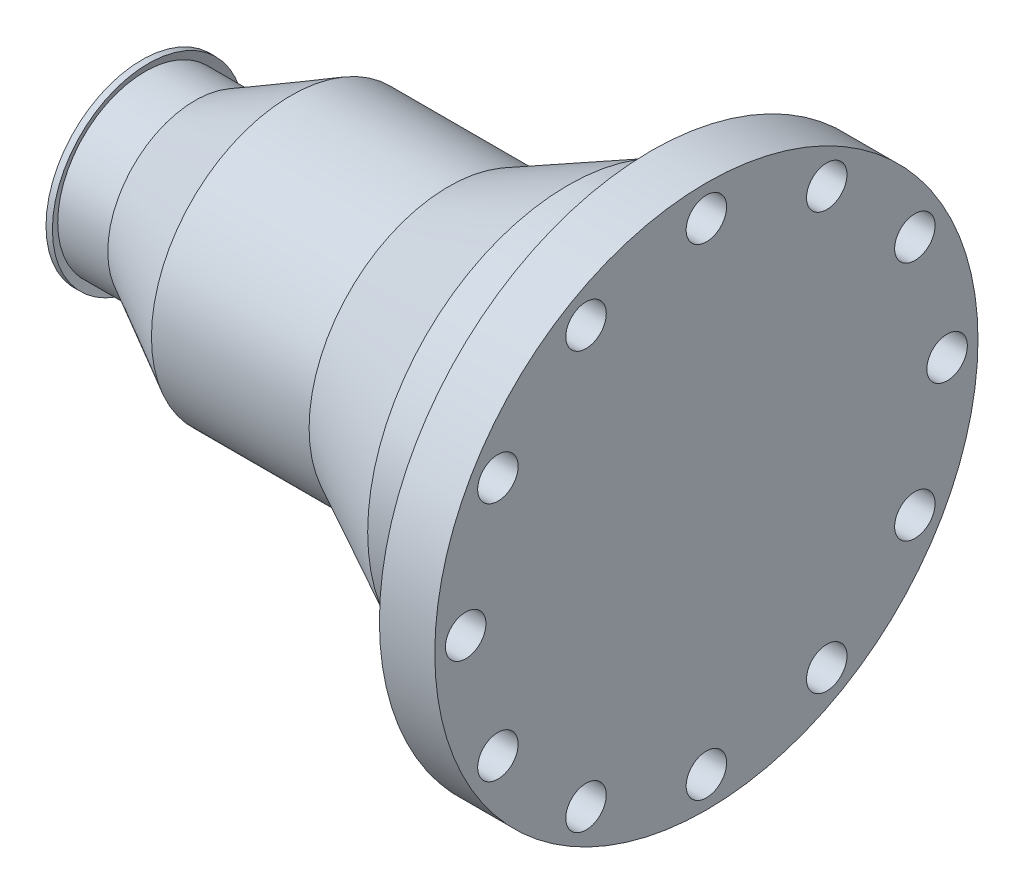
from build123d import *

# Parameters (mm, degrees)
SKETCH_3_R           = 9.5
CUT_EXTRUDE_1_DEPTH  = 321.526909947
SKETCH_4_R           = 9.5
CUT_EXTRUDE_2_DEPTH  = 321.526909947
SKETCH_5_R           = 9.5
CUT_EXTRUDE_3_DEPTH  = 321.526909947
SKETCH_6_R           = 9.5
CUT_EXTRUDE_4_DEPTH  = 321.526909947
SKETCH_7_R           = 9.5
CUT_EXTRUDE_5_DEPTH  = 321.526909947
SKETCH_8_R           = 9.5
CUT_EXTRUDE_6_DEPTH  = 321.526909947
SKETCH_9_R           = 9.5
CUT_EXTRUDE_7_DEPTH  = 321.526909947
SKETCH_10_R          = 9.5
CUT_EXTRUDE_8_DEPTH  = 321.526909947
SKETCH_11_R          = 9.5
CUT_EXTRUDE_9_DEPTH  = 321.526909947
SKETCH_12_R          = 9.5
CUT_EXTRUDE_10_DEPTH = 321.526909947
SKETCH_13_R          = 9.5
CUT_EXTRUDE_11_DEPTH = 321.526909947
SKETCH_14_R          = 9.5
CUT_EXTRUDE_12_DEPTH = 321.526909947


with BuildPart() as part:
    # Эскиз1 → Повернуть1 (revolve)
    with BuildSketch(Plane.XY, mode=Mode.PRIVATE) as revolve_1_sk:
        Polygon((0, 0), (265, 0), (265, 127.5), (239, 127.5), (239, 100), (239, 95), (220, 95), (220, 94), (200, 94), (144, 65.5), (70, 65.5), (25, 41), (1.5, 41), (3, 45), (0, 45), align=None)
    revolve(revolve_1_sk.sketch.rotate(Axis((0, 0, 0), (1, 0, 0)), 90), axis=Axis((0, 0, 0), (1, 0, 0)))

    # Эскиз2 → Вырез-Повернуть1 (revolve, cut)
    with BuildSketch(Plane.XY, mode=Mode.PRIVATE) as cut_revolve_1_sk:
        with BuildLine():
            Line((0, 0), (220, 0))
            Line((220, 0), (220, 38.502577))
            Line((220, 38.502577), (200, 38.502577))
            Line((200, 38.502577), (200, 55))
            Line((200, 55), (147.669872, 55))
            ThreePointArc((147.669872, 55), (146.273624348, 54.108499061), (146.669872, 52.5))
            Line((146.669872, 52.5), (143.5, 52.5))
            ThreePointArc((143.5, 52.5), (142.75, 52.602347572), (142, 52.5))
            Line((142, 52.5), (90, 52.5))
            ThreePointArc((90, 52.5), (79.13262933, 46.740617582), (70, 38.502577))
            Line((70, 38.502577), (42, 31))
            Line((42, 31), (0, 31))
            Line((0, 31), (0, 0))
        make_face()
    revolve(cut_revolve_1_sk.sketch.rotate(Axis((0, 0, 0), (1, 0, 0)), 90), axis=Axis((0, 0, 0), (1, 0, 0)), mode=Mode.SUBTRACT)

    # Эскиз3 → Вырез-Вытянуть1 (cut, through all)
    with BuildSketch(Plane(origin=(0, 0, 0), x_dir=(0, 0, -1), z_dir=(1, 0, 0))):
        with Locations((0, 113)):
            Circle(SKETCH_3_R)
    extrude(amount=CUT_EXTRUDE_1_DEPTH, mode=Mode.SUBTRACT)

    # Эскиз4 → Вырез-Вытянуть2 (cut, through all)
    with BuildSketch(Plane(origin=(0, 0, 0), x_dir=(0, 0, -1), z_dir=(1, 0, 0))):
        with Locations((-56.5, 97.860870628)):
            Circle(SKETCH_4_R)
    extrude(amount=CUT_EXTRUDE_2_DEPTH, mode=Mode.SUBTRACT)

    # Эскиз5 → Вырез-Вытянуть3 (cut, through all)
    with BuildSketch(Plane(origin=(0, 0, 0), x_dir=(0, 0, -1), z_dir=(1, 0, 0))):
        with Locations((-97.860870628, 56.5)):
            Circle(SKETCH_5_R)
    extrude(amount=CUT_EXTRUDE_3_DEPTH, mode=Mode.SUBTRACT)

    # Эскиз6 → Вырез-Вытянуть4 (cut, through all)
    with BuildSketch(Plane(origin=(0, 0, 0), x_dir=(0, 0, -1), z_dir=(1, 0, 0))):
        with Locations((-113, 0)):
            Circle(SKETCH_6_R)
    extrude(amount=CUT_EXTRUDE_4_DEPTH, mode=Mode.SUBTRACT)

    # Эскиз7 → Вырез-Вытянуть5 (cut, through all)
    with BuildSketch(Plane(origin=(0, 0, 0), x_dir=(0, 0, -1), z_dir=(1, 0, 0))):
        with Locations((-97.860870628, -56.5)):
            Circle(SKETCH_7_R)
    extrude(amount=CUT_EXTRUDE_5_DEPTH, mode=Mode.SUBTRACT)

    # Эскиз8 → Вырез-Вытянуть6 (cut, through all)
    with BuildSketch(Plane(origin=(0, 0, 0), x_dir=(0, 0, -1), z_dir=(1, 0, 0))):
        with Locations((-56.5, -97.860870628)):
            Circle(SKETCH_8_R)
    extrude(amount=CUT_EXTRUDE_6_DEPTH, mode=Mode.SUBTRACT)

    # Эскиз9 → Вырез-Вытянуть7 (cut, through all)
    with BuildSketch(Plane(origin=(0, 0, 0), x_dir=(0, 0, -1), z_dir=(1, 0, 0))):
        with Locations((0, -113)):
            Circle(SKETCH_9_R)
    extrude(amount=CUT_EXTRUDE_7_DEPTH, mode=Mode.SUBTRACT)

    # Эскиз10 → Вырез-Вытянуть8 (cut, through all)
    with BuildSketch(Plane(origin=(0, 0, 0), x_dir=(0, 0, -1), z_dir=(1, 0, 0))):
        with Locations((56.5, -97.860870628)):
            Circle(SKETCH_10_R)
    extrude(amount=CUT_EXTRUDE_8_DEPTH, mode=Mode.SUBTRACT)

    # Эскиз11 → Вырез-Вытянуть9 (cut, through all)
    with BuildSketch(Plane(origin=(0, 0, 0), x_dir=(0, 0, -1), z_dir=(1, 0, 0))):
        with Locations((97.860870628, -56.5)):
            Circle(SKETCH_11_R)
    extrude(amount=CUT_EXTRUDE_9_DEPTH, mode=Mode.SUBTRACT)

    # Эскиз12 → Вырез-Вытянуть10 (cut, through all)
    with BuildSketch(Plane(origin=(0, 0, 0), x_dir=(0, 0, -1), z_dir=(1, 0, 0))):
        with Locations((113, 0)):
            Circle(SKETCH_12_R)
    extrude(amount=CUT_EXTRUDE_10_DEPTH, mode=Mode.SUBTRACT)

    # Эскиз13 → Вырез-Вытянуть11 (cut, through all)
    with BuildSketch(Plane(origin=(0, 0, 0), x_dir=(0, 0, -1), z_dir=(1, 0, 0))):
        with Locations((97.860870628, 56.5)):
            Circle(SKETCH_13_R)
    extrude(amount=CUT_EXTRUDE_11_DEPTH, mode=Mode.SUBTRACT)

    # Эскиз14 → Вырез-Вытянуть12 (cut, through all)
    with BuildSketch(Plane(origin=(0, 0, 0), x_dir=(0, 0, -1), z_dir=(1, 0, 0))):
        with Locations((56.5, 97.860870628)):
            Circle(SKETCH_14_R)
    extrude(amount=CUT_EXTRUDE_12_DEPTH, mode=Mode.SUBTRACT)


solid = part.part
